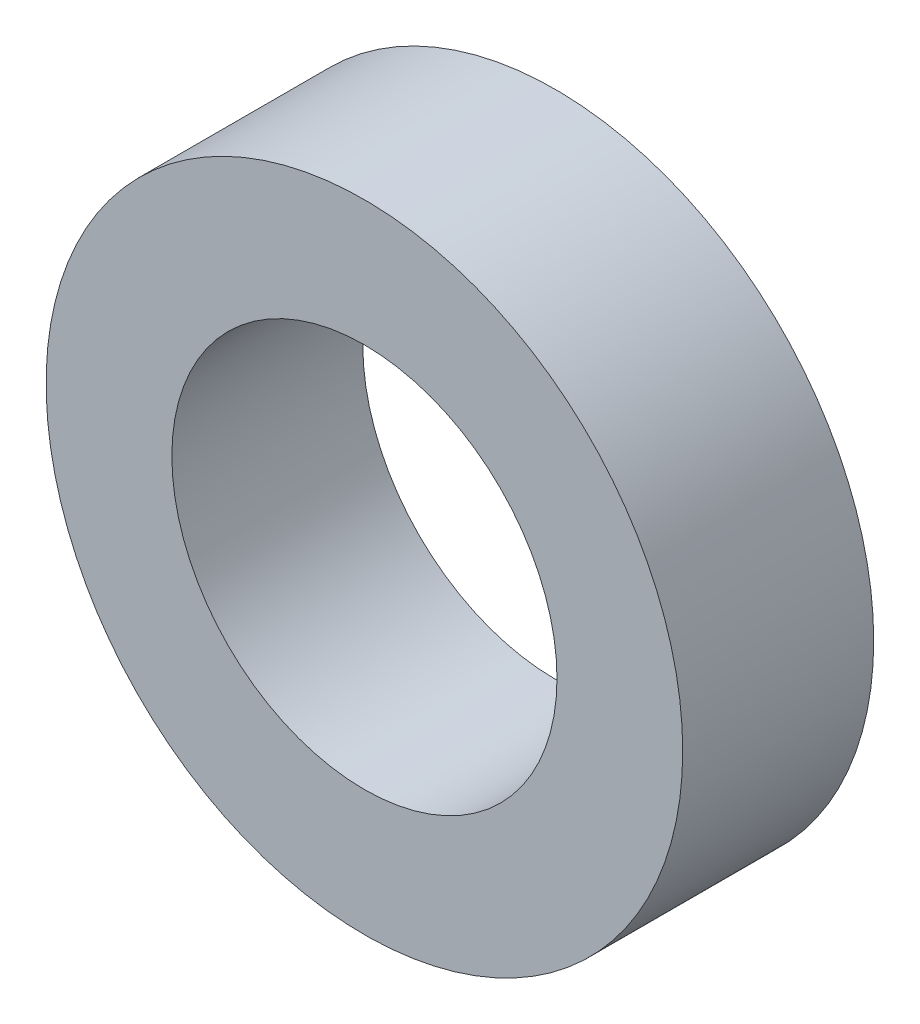
from build123d import *

# Parameters (mm, degrees)
SKETCH1_R           = 5
SKETCH1_R_2         = 3.025
BOSS_EXTRUDE1_DEPTH = 3


with BuildPart() as part:
    # Sketch1 → Boss-Extrude1 (new body)
    with BuildSketch(Plane.XY):
        Circle(SKETCH1_R)
        Circle(SKETCH1_R_2, mode=Mode.SUBTRACT)
    extrude(amount=BOSS_EXTRUDE1_DEPTH)


solid = part.part
